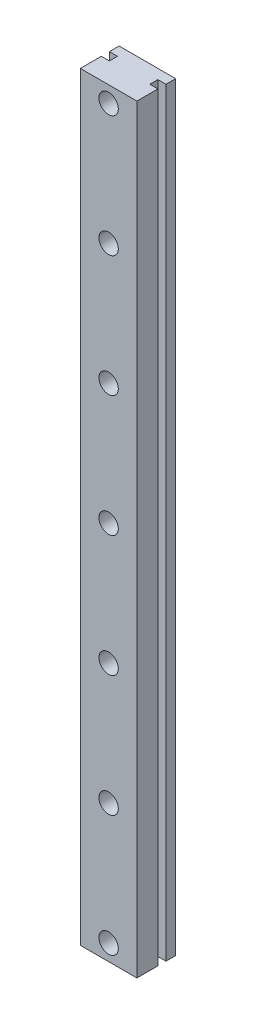
from build123d import *

# Parameters (mm, degrees)
EXTRUDE_1_DEPTH     = 94
SKETCH_2_R          = 1.2
CUT_EXTRUDE_1_DEPTH = 95.382413616


with BuildPart() as part:
    # 草图1 → 凸台-拉伸1 (new body)
    with BuildSketch(Plane(origin=(0, 0, 0), x_dir=(1, 0, 0), z_dir=(0, 1, 0))):
        Polygon((0, 0), (0, 2.6), (1, 2.6), (1, 3.6), (0, 3.6), (0, 4.8), (7, 4.8), (7, 3.6), (6, 3.6), (6, 2.6), (7, 2.6), (7, 0), align=None)
    extrude(amount=EXTRUDE_1_DEPTH)

    # 草图2 → 切除-拉伸1 (cut, through all)
    with BuildSketch(Plane(origin=(0, 0, -4.8), x_dir=(-1, 0, 0), z_dir=(0, 0, -1))):
        with Locations((-3.5, 62)):
            Circle(SKETCH_2_R)
        with Locations((-3.5, 77)):
            Circle(SKETCH_2_R)
        with Locations((-3.5, 47)):
            Circle(SKETCH_2_R)
        with Locations((-3.5, 32)):
            Circle(SKETCH_2_R)
        with Locations((-3.5, 17)):
            Circle(SKETCH_2_R)
        with Locations((-3.5, 92)):
            Circle(SKETCH_2_R)
        with Locations((-3.5, 2)):
            Circle(SKETCH_2_R)
    extrude(amount=-CUT_EXTRUDE_1_DEPTH, mode=Mode.SUBTRACT)


solid = part.part
